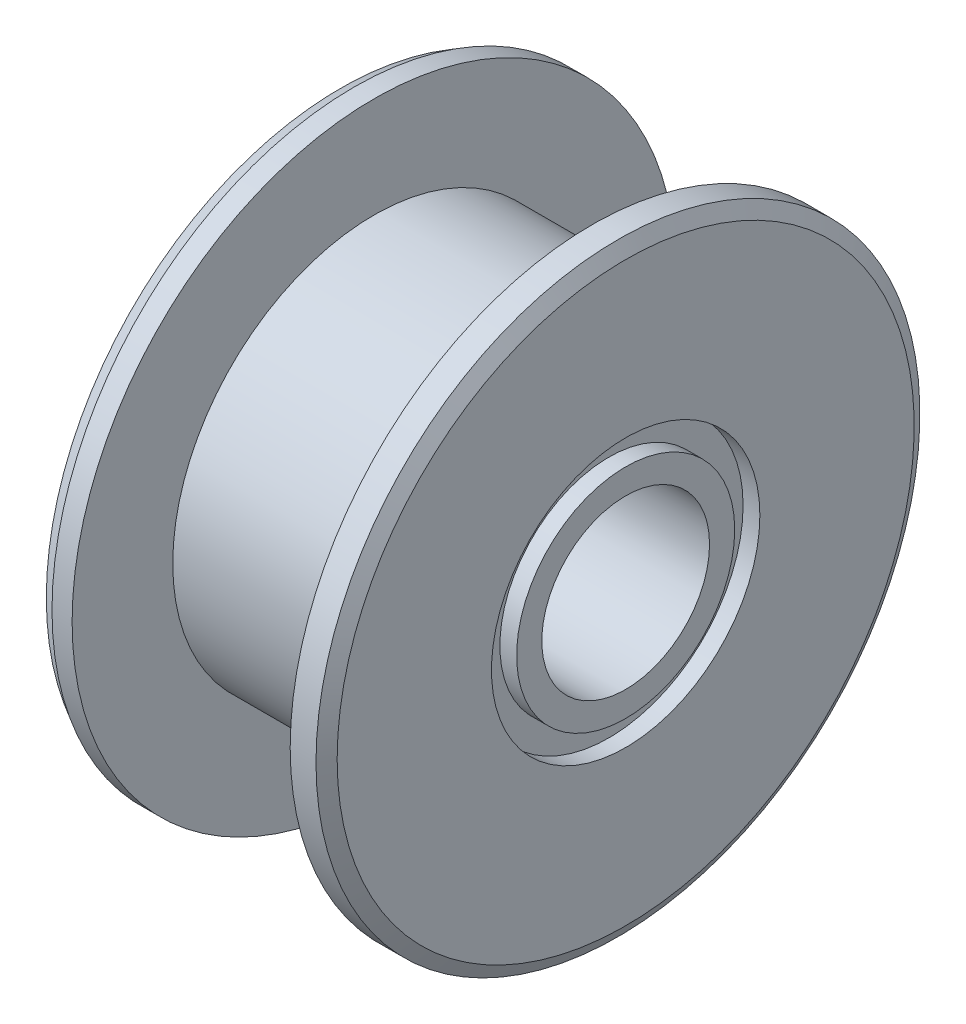
from build123d import *
from OCP.BRepFilletAPI import BRepFilletAPI_MakeChamfer

# Parameters (mm, degrees)
CHAMFER1_SIZE      = 0.4
CHAMFER1_SIZE2     = 0.230940108
SKETCH2_R          = 2.5
CUT_EXTRUDE1_DEPTH = 16.305227865
SKETCH3_R          = 4
SKETCH3_R_2        = 3.25
CUT_EXTRUDE2_DEPTH = 0.5
CUT_EXTRUDE3_START = -0.5
SKETCH4_R          = 4
SKETCH4_R_2        = 3.25
CUT_EXTRUDE3_DEPTH = 0.5


with BuildPart() as part:
    # Sketch1 → Revolve1 (revolve)
    with BuildSketch(Plane.XY, mode=Mode.PRIVATE) as revolve1_sk:
        Polygon((0, 0), (0, 9), (1, 9), (1, 6), (7.5, 6), (7.5, 9), (8.5, 9), (8.5, 0), align=None)
    revolve(revolve1_sk.sketch.rotate(Axis((0, 0, 0), (1, 0, 0)), 90), axis=Axis((0, 0, 0), (1, 0, 0)))

    # Chamfer1: one chamfer whose edges measure the first distance from different faces: ONE call of the kernel's chamfer builder (chamfer() names one face for all edges)
    chamfer1_edges_1 = [part.edges().sort_by_distance(p)[0] for p in [
        (8.5, 0, -9),
    ]]
    chamfer1_side_1 = [part.faces().sort_by_distance(p)[0] for p in [
        (8.5, 0, 0),
    ]]
    chamfer1_edges_2 = [part.edges().sort_by_distance(p)[0] for p in [
        (0, 0, -9),
    ]]
    chamfer1_side_2 = [part.faces().sort_by_distance(p)[0] for p in [
        (0.5, 0, -9),
    ]]
    chamfer1 = BRepFilletAPI_MakeChamfer(part.part.solid().wrapped)
    for e in chamfer1_edges_1:
        chamfer1.Add(CHAMFER1_SIZE, CHAMFER1_SIZE2, e.wrapped, chamfer1_side_1[0].wrapped)  # the first distance lies on this face
    for e in chamfer1_edges_2:
        chamfer1.Add(CHAMFER1_SIZE, CHAMFER1_SIZE2, e.wrapped, chamfer1_side_2[0].wrapped)  # the first distance lies on this face
    add(Compound.cast(chamfer1.Shape()), mode=Mode.REPLACE)

    # Sketch2 → Cut-Extrude1 (cut, through all)
    with BuildSketch(Plane(origin=(8.5, 0, 0), x_dir=(0, 0, -1), z_dir=(1, 0, 0))):
        Circle(SKETCH2_R)
    extrude(amount=-CUT_EXTRUDE1_DEPTH, mode=Mode.SUBTRACT)

    # Sketch3 → Cut-Extrude2 (cut)
    with BuildSketch(Plane(origin=(8.5, 0, 0), x_dir=(0, 0, -1), z_dir=(1, 0, 0))):
        Circle(SKETCH3_R)
        Circle(SKETCH3_R_2, mode=Mode.SUBTRACT)
    extrude(amount=-CUT_EXTRUDE2_DEPTH, mode=Mode.SUBTRACT)

    # Sketch4 → Cut-Extrude3 (cut)
    with BuildSketch(Plane.ZY.offset(CUT_EXTRUDE3_START)):
        with Locations(Location((0, 0, 0), (0, 0, 180))):
            Circle(SKETCH4_R)
        with Locations(Location((0, 0, 0), (0, 0, 180))):
            Circle(SKETCH4_R_2, mode=Mode.SUBTRACT)
    extrude(amount=CUT_EXTRUDE3_DEPTH, mode=Mode.SUBTRACT)


solid = part.part
